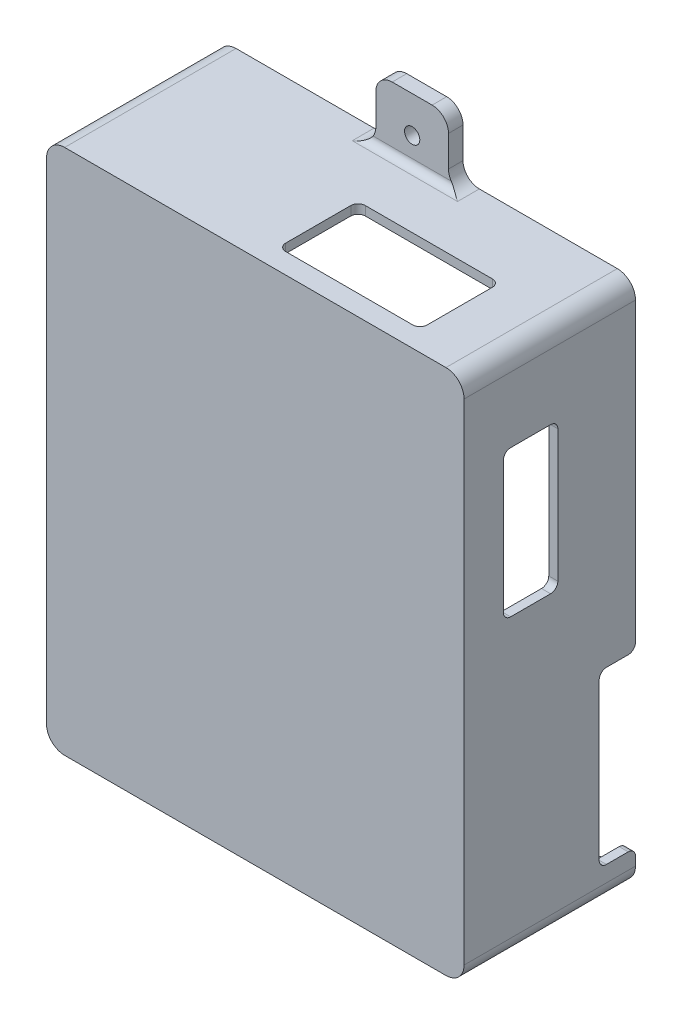
from build123d import *

# Parameters (mm, degrees)
SKETCH1_W           = 110
SKETCH1_H           = 140
BOSS_EXTRUDE2_DEPTH = 2.5
SKETCH2_W           = 110
SKETCH2_H           = 47.2
BOSS_EXTRUDE3_DEPTH = 2.5
SKETCH3_W           = 110
SKETCH3_H           = 47.2
BOSS_EXTRUDE4_DEPTH = 2.5
SKETCH4_W           = 47.2
SKETCH4_H           = 145
BOSS_EXTRUDE5_DEPTH = 2.5
BOSS_EXTRUDE6_DEPTH = 2.5
FILLET1_R           = 5
SKETCH8_W           = 20
SKETCH8_H           = 17.5
SKETCH8_R           = 2.1
BOSS_EXTRUDE7_DEPTH = 4
FILLET2_R           = 4.5
FILLET3_R           = 2
FILLET4_R           = 2
SKETCH10_W          = 27.188928792
SKETCH10_H          = 10
CUT_EXTRUDE1_DEPTH  = 2.5
SKETCH11_W          = 30.376596305
SKETCH11_H          = 16.688376982
BOSS_EXTRUDE8_DEPTH = 2.5
SKETCH13_W          = 10
SKETCH13_H          = 47
SKETCH13_W_2        = 15
SKETCH13_H_2        = 40.335597964
CUT_EXTRUDE2_DEPTH  = 2.5
SKETCH14_W          = 39.002049577
SKETCH14_H          = 21.938652887
CUT_EXTRUDE3_DEPTH  = 2.5
FILLET5_R           = 2


with BuildPart() as part:
    # Sketch1 → Boss-Extrude2 (new body)
    with BuildSketch(Plane.XY):
        with Locations((49.167763787, -80.682426657)):
            Rectangle(SKETCH1_W, SKETCH1_H)
    extrude(amount=BOSS_EXTRUDE2_DEPTH)

    # Sketch2 → Boss-Extrude3 (add)
    with BuildSketch(Plane.XZ.offset(150.682426657)):
        with Locations((49.167763787, -21.1)):
            Rectangle(SKETCH2_W, SKETCH2_H)
    extrude(amount=BOSS_EXTRUDE3_DEPTH)

    # Sketch3 → Boss-Extrude4 (add)
    with BuildSketch(Plane(origin=(0, -10.682426657, 0), x_dir=(1, 0, 0), z_dir=(0, 1, 0))):
        with Locations((49.167763787, 21.1)):
            Rectangle(SKETCH3_W, SKETCH3_H)
    extrude(amount=BOSS_EXTRUDE4_DEPTH)

    # Sketch4 → Boss-Extrude5 (add)
    with BuildSketch(Plane(origin=(104.167763787, 0, 0), x_dir=(0, 0, -1), z_dir=(1, 0, 0))):
        with Locations((21.1, -80.682426657)):
            Rectangle(SKETCH4_W, SKETCH4_H)
    extrude(amount=BOSS_EXTRUDE5_DEPTH)

    # Sketch7 → Boss-Extrude6 (add)
    with BuildSketch(Plane.ZY.offset(5.832236213)):
        Polygon((2.5, -8.182426657), (-44.7, -8.182426657), (-44.7, -15.757207328), (-39.7, -15.757207328), (-39.7, -63.462848096), (-44.7, -63.462848096), (-44.7, -97.902005218), (-39.7, -97.902005218), (-39.7, -145.607645986), (-44.7, -145.607645986), (-44.7, -153.182426657), (2.5, -153.182426657), align=None)
    extrude(amount=BOSS_EXTRUDE6_DEPTH)

    # Fillet1
    fillet1_edges = [part.edges().sort_by_distance(p)[0] for p in [
        (-5.832236213, -150.682426657, -22.35),
        (104.167763787, -150.682426657, -22.35),
        (104.167763787, -10.682426657, -22.35),
        (-5.832236213, -10.682426657, -22.35),
        (106.667763787, -153.182426657, -21.1),
        (106.667763787, -8.182426657, -21.1),
        (-8.332236213, -8.182426657, -21.1),
        (-8.332236213, -153.182426657, -21.1),
    ]]
    fillet(fillet1_edges, radius=FILLET1_R)

    # Sketch8 → Boss-Extrude7 (add)
    # profile 1 of 2: a face of its own
    with BuildSketch(Plane.XY.offset(-44.7)):
        with Locations((49.167763787, 0.567573343)):
            Rectangle(SKETCH8_W, SKETCH8_H)
        with Locations((49.167763787, -0.682426657)):
            Circle(SKETCH8_R, mode=Mode.SUBTRACT)
    # profile 2 of 2: a face of its own
    with BuildSketch(Plane.XY.offset(-44.7)):
        with Locations((49.167763787, -161.932426657)):
            Rectangle(SKETCH8_W, SKETCH8_H)
        with Locations((49.167763787, -160.682426657)):
            Circle(SKETCH8_R, mode=Mode.SUBTRACT)
    extrude(amount=BOSS_EXTRUDE7_DEPTH)

    # Fillet2
    fillet2_edges = [part.edges().sort_by_distance(p)[0] for p in [
        (39.167763787, -8.182426657, -42.7),
        (59.167763787, -8.182426657, -42.7),
        (59.167763787, 9.317573343, -42.7),
        (39.167763787, 9.317573343, -42.7),
        (39.167763787, -170.682426657, -42.7),
        (59.167763787, -170.682426657, -42.7),
        (59.167763787, -153.182426657, -42.7),
        (39.167763787, -153.182426657, -42.7),
    ]]
    fillet(fillet2_edges, radius=FILLET2_R)

    # Fillet3
    fillet3_edges = [part.edges().sort_by_distance(p)[0] for p in [
        (-7.082236213, -15.757207328, -44.7),
        (-7.082236213, -15.757207328, -39.7),
        (-7.082236213, -63.462848096, -39.7),
        (-7.082236213, -63.462848096, -44.7),
        (-7.082236213, -97.902005218, -44.7),
        (-7.082236213, -97.902005218, -39.7),
        (-7.082236213, -145.607645986, -39.7),
        (-7.082236213, -145.607645986, -44.7),
    ]]
    fillet(fillet3_edges, radius=FILLET3_R)

    # Fillet4
    fillet4_edges = [part.edges().sort_by_distance(p)[0] for p in [
        (49.167763787, -8.182426657, -40.7),
        (49.167763787, -153.182426657, -40.7),
    ]]
    fillet(fillet4_edges, radius=FILLET4_R)

    # Sketch10 → Cut-Extrude1 (cut)
    with BuildSketch(Plane.XZ.offset(153.182426657)):
        with Locations((18.884922409, -39.7)):
            Rectangle(SKETCH10_W, SKETCH10_H)
        with Locations((81.888233264, -39.7)):
            Rectangle(SKETCH10_W, SKETCH10_H)
    extrude(amount=-CUT_EXTRUDE1_DEPTH, mode=Mode.SUBTRACT)

    # Sketch11 → Boss-Extrude8 (add)
    with BuildSketch(Plane(origin=(0, -8.182426657, 0), x_dir=(1, 0, 0), z_dir=(0, 1, 0))):
        with Locations((74.481594042, 13.130831216)):
            Rectangle(SKETCH11_W, SKETCH11_H)
    extrude(amount=-BOSS_EXTRUDE8_DEPTH)

    # Sketch13 → Cut-Extrude2 (cut)
    with BuildSketch(Plane(origin=(106.667763787, 0, 0), x_dir=(0, 0, -1), z_dir=(1, 0, 0))):
        with Locations((39.7, -120.28356874)):
            Rectangle(SKETCH13_W, SKETCH13_H)
        with Locations((15.816287793, -51.369975871)):
            Rectangle(SKETCH13_W_2, SKETCH13_H_2)
    extrude(amount=-CUT_EXTRUDE2_DEPTH, mode=Mode.SUBTRACT)

    # Sketch14 → Cut-Extrude3 (cut)
    with BuildSketch(Plane(origin=(0, -8.182426657, 0), x_dir=(1, 0, 0), z_dir=(0, 1, 0))):
        with Locations((69.418827991, 14.068380485)):
            Rectangle(SKETCH14_W, SKETCH14_H)
    extrude(amount=-CUT_EXTRUDE3_DEPTH, mode=Mode.SUBTRACT)

    # Fillet5
    fillet5_edges = [part.edges().sort_by_distance(p)[0] for p in [
        (5.290458013, -151.932426657, -44.7),
        (5.290458013, -151.932426657, -34.7),
        (32.479386805, -151.932426657, -34.7),
        (32.479386805, -151.932426657, -44.7),
        (68.293768868, -151.932426657, -44.7),
        (68.293768868, -151.932426657, -34.7),
        (95.48269766, -151.932426657, -34.7),
        (95.48269766, -151.932426657, -44.7),
        (105.417763787, -143.78356874, -34.7),
        (105.417763787, -96.78356874, -34.7),
        (105.417763787, -96.78356874, -44.7),
        (105.417763787, -143.78356874, -44.7),
        (105.417763787, -71.537774853, -8.316287793),
        (105.417763787, -31.202176889, -8.316287793),
        (105.417763787, -31.202176889, -23.316287793),
        (105.417763787, -71.537774853, -23.316287793),
        (88.919852779, -9.432426657, -25.037706928),
        (88.919852779, -9.432426657, -3.099054041),
        (49.917803202, -9.432426657, -3.099054041),
        (49.917803202, -9.432426657, -25.037706928),
    ]]
    fillet(fillet5_edges, radius=FILLET5_R)


solid = part.part
